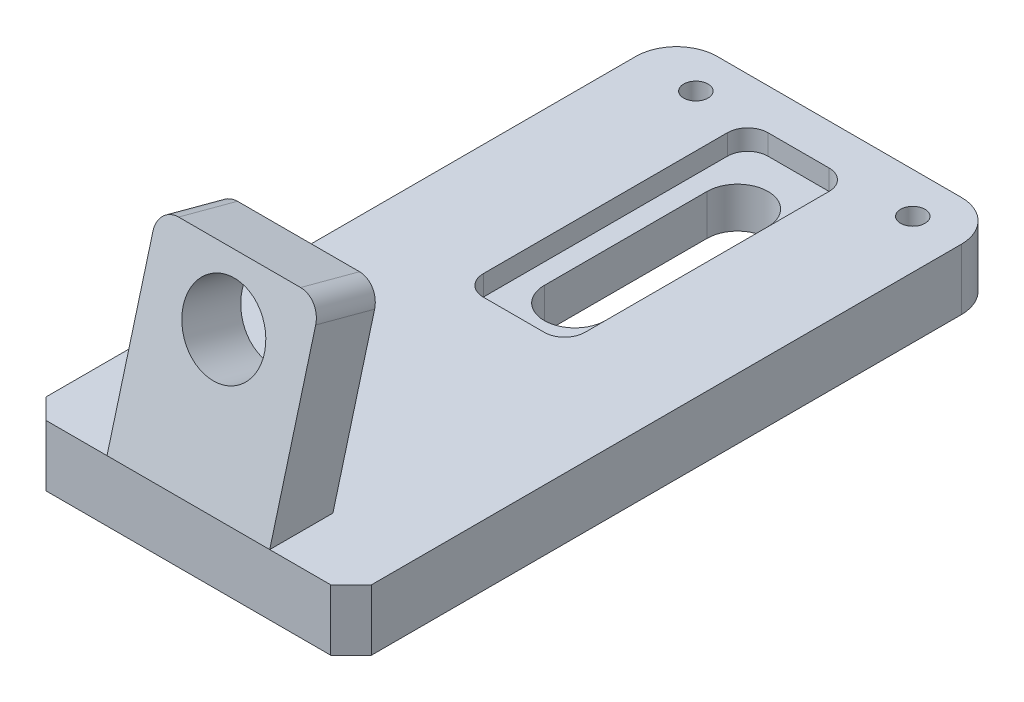
from build123d import *

# Parameters (mm, degrees)
BOSS_EXTRUDE1_DEPTH            = 15
CUT_EXTRUDE1_DEPTH             = 5
BOSS_EXTRUDE2_DEPTH            = 20
BOSS_EXTRUDE2_DEPTH_BACK       = 20
SKETCH4_R                      = 10
CUT_EXTRUDE2_DEPTH             = 20
FILLET1_R                      = 5
M6X1_0_TAPPED_HOLE1_AT_2_COUNT = 2
M6X1_0_TAPPED_HOLE1_AT_2_PITCH = 53.333333333


with BuildPart() as part:
    # Sketch1 → Boss-Extrude1 (new body)
    with BuildSketch(Plane(origin=(0, 0, 0), x_dir=(1, 0, 0), z_dir=(0, 1, 0))):
        with BuildLine():
            Line((-40, -75), (-35, -80))
            Line((-35, -80), (35, -80))
            Line((35, -80), (40, -75))
            Line((40, -75), (40, 70))
            ThreePointArc((40, 70), (37.071067812, 77.071067812), (30, 80))
            Line((30, 80), (-30, 80))
            ThreePointArc((-30, 80), (-37.071067812, 77.071067812), (-40, 70))
            Line((-40, 70), (-40, -75))
        make_face()
        with BuildLine():
            Line((-7.5, 15), (-7.5, 55))
            ThreePointArc((-7.5, 55), (0, 62.5), (7.5, 55))
            Line((7.5, 55), (7.5, 15))
            ThreePointArc((7.5, 15), (0, 7.5), (-7.5, 15))
        make_face(mode=Mode.SUBTRACT)
    extrude(amount=BOSS_EXTRUDE1_DEPTH)

    # Sketch2 → Cut-Extrude1 (cut)
    with BuildSketch(Plane(origin=(0, 15, 0), x_dir=(1, 0, 0), z_dir=(0, 1, 0))):
        with BuildLine():
            Line((-7.5, 70), (7.5, 70))
            ThreePointArc((7.5, 70), (11.035533906, 68.535533906), (12.5, 65))
            Line((12.5, 65), (12.5, 5))
            ThreePointArc((12.5, 5), (11.035533906, 1.464466094), (7.5, 0))
            Line((7.5, 0), (-7.5, 0))
            ThreePointArc((-7.5, 0), (-11.035533906, 1.464466094), (-12.5, 5))
            Line((-12.5, 5), (-12.5, 65))
            ThreePointArc((-12.5, 65), (-11.035533906, 68.535533906), (-7.5, 70))
        make_face()
    extrude(amount=-CUT_EXTRUDE1_DEPTH, mode=Mode.SUBTRACT)

    # Sketch7 → M6x1.0 Tapped Hole1 (revolve, cut)
    with BuildSketch(Plane(origin=(-25.246007907, 15, -70), x_dir=(0, 0, 1), z_dir=(1, 0, 0))):
        Polygon((0, 0), (0, 9.502151548), (2.5, 8), (2.5, 5), (3, 5), (3, 0), align=None)
    m6x1_0_tapped_hole1 = revolve(axis=Axis((-25.246007907, 21.35, -70), (0, -1, 0)), mode=Mode.SUBTRACT)

    # M6x1.0 Tapped Hole1 at 2: M6x1.0 Tapped Hole1 ×2
    with Locations(*[(i * M6X1_0_TAPPED_HOLE1_AT_2_PITCH, 0, 0) for i in range(1, M6X1_0_TAPPED_HOLE1_AT_2_COUNT)]):
        add(m6x1_0_tapped_hole1, mode=Mode.SUBTRACT)


with BuildPart() as body_2:
    # Sketch3 → Boss-Extrude2 (new, two sides: drawn at the far end of the back side and taken through both)
    with BuildSketch(Plane(origin=(0, 0, 0), x_dir=(0, 0, -1), z_dir=(1, 0, 0)).offset(-BOSS_EXTRUDE2_DEPTH_BACK)):
        Polygon((-64.470857294, 15), (-80, 15), (-67.406387956, 62), (-52.917500561, 58.117714323), align=None)
    extrude(amount=BOSS_EXTRUDE2_DEPTH + BOSS_EXTRUDE2_DEPTH_BACK)

    # Sketch4 → Cut-Extrude2 (cut)
    with BuildSketch(Plane(origin=(0, 21.004809472, 78.391016151), x_dir=(1, 0, 0), z_dir=(0, 0.25881904510251763, 0.9659258262890692))):
        with Locations(Location((0, 27.441344265, 0), (0, 0, 270))):
            Circle(SKETCH4_R)
    extrude(amount=-CUT_EXTRUDE2_DEPTH, mode=Mode.SUBTRACT)

    # Fillet1
    fillet1_edges = [body_2.edges().sort_by_distance(p)[0] for p in [
        (20, 60.058857162, 60.161944259),
        (-20, 60.058857162, 60.161944259),
    ]]
    fillet(fillet1_edges, radius=FILLET1_R)


solid = Compound([part.part, body_2.part])
